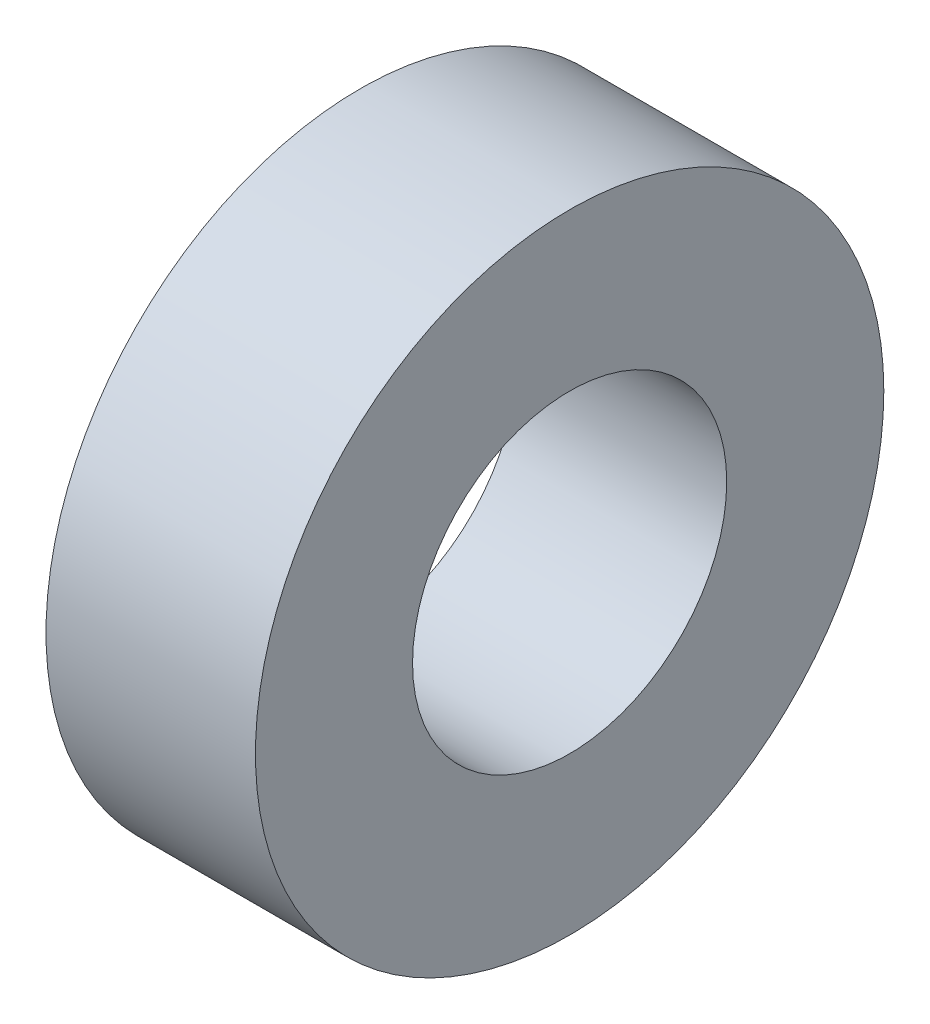
from build123d import *

# Parameters (mm, degrees)
SKETCH_1_R      = 3
SKETCH_1_R_2    = 1.5
EXTRUDE_1_DEPTH = 2


with BuildPart() as part:
    # ｽｹｯﾁ1 → ﾎﾞｽ - 押し出し1 (new body)
    with BuildSketch(Plane(origin=(0, 0, 0), x_dir=(0, 0, -1), z_dir=(1, 0, 0))):
        Circle(SKETCH_1_R)
        Circle(SKETCH_1_R_2, mode=Mode.SUBTRACT)
    extrude(amount=EXTRUDE_1_DEPTH)


solid = part.part
